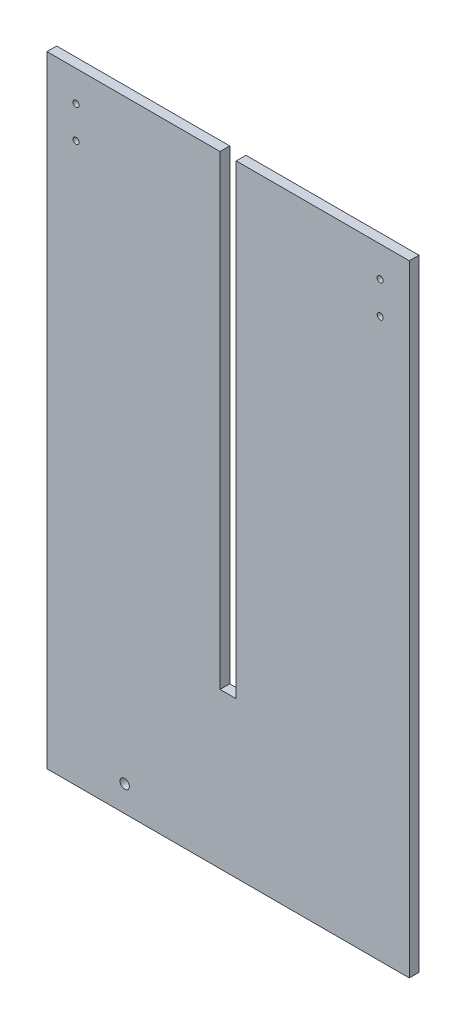
from build123d import *

# Parameters (mm, degrees)
SKETCH2_W           = 4.7625
SKETCH2_H           = 44.223214285
SKETCH2_H_2         = 44.223214286
SKETCH2_W_2         = 21.998214286
SKETCH2_H_3         = 4.7625
SKETCH2_W_3         = 26.760714286
BOSS_EXTRUDE1_DEPTH = 4.7625
SKETCH3_W           = 7.9375
SKETCH3_H           = 228.6
CUT_EXTRUDE1_DEPTH  = 184.017476539
SKETCH4_R           = 2.3
CUT_EXTRUDE2_DEPTH  = 184.017476539
SKETCH5_R           = 1.5
CUT_EXTRUDE3_DEPTH  = 4.7625
SKETCH6_W           = 4.7625
SKETCH6_H           = 44.223214286
BOSS_EXTRUDE2_DEPTH = 4.7625
SKETCH7_W           = 26.760714286
SKETCH7_H           = 4.7625
CUT_EXTRUDE4_DEPTH  = 4.7625
SKETCH9_W           = 4.7625
SKETCH9_H           = 221.116071428
SKETCH9_W_2         = 21.998214286
SKETCH9_H_2         = 4.7625
CUT_EXTRUDE5_DEPTH  = 4.7625


with BuildPart() as part:
    # Sketch2 → Boss-Extrude1 (new body)
    with BuildSketch(Plane.XY):
        Polygon((0, -152.4), (0, 152.4), (-88.9, 152.4), (-88.9, 108.176785714), (-88.9, 63.953571429), (-88.9, 19.730357143), (-88.9, -24.492857143), (-88.9, -68.716071429), (-88.9, -112.939285714), (-88.9, -152.4), (-66.901785714, -152.4), (-40.141071429, -152.4), (-13.380357143, -152.4), align=None)
        Polygon((88.9, 152.4), (0, 152.4), (0, -152.4), (13.380357143, -152.4), (40.141071429, -152.4), (66.901785714, -152.4), (88.9, -152.4), (88.9, -112.939285714), (88.9, -68.716071429), (88.9, -24.492857143), (88.9, 19.730357143), (88.9, 63.953571429), (88.9, 108.176785714), align=None)
        with Locations((-91.28125, 86.065178572)):
            Rectangle(SKETCH2_W, SKETCH2_H)
        with Locations((-91.28125, -2.38125)):
            Rectangle(SKETCH2_W, SKETCH2_H_2)
        with Locations((-91.28125, -90.827678572)):
            Rectangle(SKETCH2_W, SKETCH2_H)
        with Locations((-77.900892857, -154.78125)):
            Rectangle(SKETCH2_W_2, SKETCH2_H_3)
        with Locations((-26.760714286, -154.78125)):
            Rectangle(SKETCH2_W_3, SKETCH2_H_3)
        with Locations((26.760714286, -154.78125)):
            Rectangle(SKETCH2_W_3, SKETCH2_H_3)
        with Locations((91.28125, -90.827678572)):
            Rectangle(SKETCH2_W, SKETCH2_H)
        with Locations((91.28125, -2.38125)):
            Rectangle(SKETCH2_W, SKETCH2_H_2)
        with Locations((91.28125, 86.065178572)):
            Rectangle(SKETCH2_W, SKETCH2_H)
        with Locations((77.900892857, -154.78125)):
            Rectangle(SKETCH2_W_2, SKETCH2_H_3)
    extrude(amount=BOSS_EXTRUDE1_DEPTH)

    # Sketch3 → Cut-Extrude1 (cut, through all)
    with BuildSketch(Plane.XY.offset(4.7625)):
        with Locations((0, 38.1)):
            Rectangle(SKETCH3_W, SKETCH3_H)
    extrude(amount=-CUT_EXTRUDE1_DEPTH, mode=Mode.SUBTRACT)

    # Sketch4 → Cut-Extrude2 (cut, through all)
    with BuildSketch(Plane.XY.offset(4.7625)):
        with Locations((-50.8, -139.7)):
            Circle(SKETCH4_R)
    extrude(amount=-CUT_EXTRUDE2_DEPTH, mode=Mode.SUBTRACT)

    # Sketch5 → Cut-Extrude3 (cut)
    with BuildSketch(Plane.XY.offset(4.7625)):
        with Locations((-74.6125, 137.4)):
            Circle(SKETCH5_R)
        with Locations((-74.6125, 121.65)):
            Circle(SKETCH5_R)
        with Locations((74.6125, 121.65)):
            Circle(SKETCH5_R)
        with Locations((74.6125, 137.4)):
            Circle(SKETCH5_R)
    extrude(amount=-CUT_EXTRUDE3_DEPTH, mode=Mode.SUBTRACT)

    # Sketch6 → Boss-Extrude2 (add)
    with BuildSketch(Plane.XY.offset(4.7625)):
        with Locations((-91.28125, 41.841964286)):
            Rectangle(SKETCH6_W, SKETCH6_H)
        with Locations((-91.28125, -46.604464286)):
            Rectangle(SKETCH6_W, SKETCH6_H)
        with Locations((91.28125, 41.841964286)):
            Rectangle(SKETCH6_W, SKETCH6_H)
        with Locations((91.28125, -46.604464286)):
            Rectangle(SKETCH6_W, SKETCH6_H)
    extrude(amount=-BOSS_EXTRUDE2_DEPTH)

    # Sketch7 → Cut-Extrude4 (cut)
    with BuildSketch(Plane.XY.offset(4.7625)):
        with Locations((-26.760714286, -154.78125)):
            Rectangle(SKETCH7_W, SKETCH7_H)
        with Locations((26.760714286, -154.78125)):
            Rectangle(SKETCH7_W, SKETCH7_H)
    extrude(amount=-CUT_EXTRUDE4_DEPTH, mode=Mode.SUBTRACT)

    # Sketch9 → Cut-Extrude5 (cut)
    with BuildSketch(Plane(origin=(0, 0, 0), x_dir=(-1, 0, 0), z_dir=(0, 0, -1))):
        with Locations((-91.28125, -2.38125)):
            Rectangle(SKETCH9_W, SKETCH9_H)
        with Locations((91.28125, -2.38125)):
            Rectangle(SKETCH9_W, SKETCH9_H)
        with Locations((-77.900892857, -154.78125)):
            Rectangle(SKETCH9_W_2, SKETCH9_H_2)
        with Locations((77.900892857, -154.78125)):
            Rectangle(SKETCH9_W_2, SKETCH9_H_2)
    extrude(amount=-CUT_EXTRUDE5_DEPTH, mode=Mode.SUBTRACT)


solid = part.part
